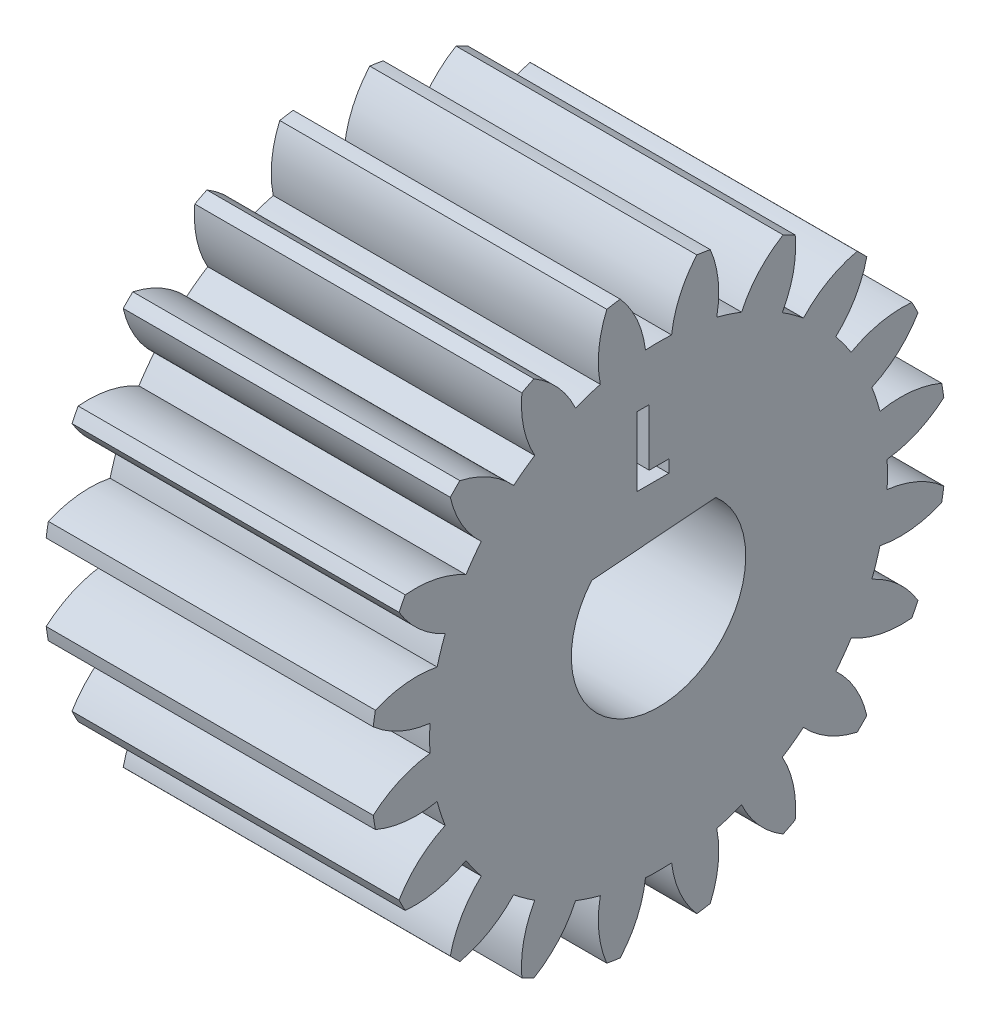
from build123d import *

# Parameters (mm, degrees)
BASPROSKE_W         = 15
BASPROSKE_H         = 13.2
TOOTHCUT_DEPTH      = 24.947442452
TEETHCUTS_COUNT     = 20
TEETHCUTS_ANGLE     = 342
BORSKE_R            = 4
BORE_DEPTH          = 50.0000508
BOSS_EXTRUDE1_START = -15
BOSS_EXTRUDE1_DEPTH = 15
SKETCH2_R           = 7.2
SKETCH2_R_2         = 6
CUT_EXTRUDE1_DEPTH  = 0.5
CUT_EXTRUDE2_DEPTH  = 2


with BuildPart() as part:
    # BasProSke → Base-Revolve (revolve)
    with BuildSketch(Plane(origin=(0, 0, 0), x_dir=(1, 0, 0), z_dir=(0, 1, 0)), mode=Mode.PRIVATE) as base_revolve_sk:
        with Locations((7.5, 6.6)):
            Rectangle(BASPROSKE_W, BASPROSKE_H)
    revolve(base_revolve_sk.sketch.rotate(Axis((-10, 0, 0), (1, 0, 0)), 180), axis=Axis((-10, 0, 0), (1, 0, 0)))

    # TooCutSke → ToothCut (cut, through all)
    with BuildSketch(Plane(origin=(0, 0, 0), x_dir=(0, 0, -1), z_dir=(1, 0, 0))):
        with BuildLine():
            ThreePointArc((0.599012827, 10.48189795), (0, 10.499), (-0.599012827, 10.48189795))
            ThreePointArc((-0.599012827, 10.48189795), (-0.986906343, 11.883983562), (-1.777012823, 13.105473306))
            ThreePointArc((-1.777012823, 13.105473306), (0, 13.2254), (1.777012823, 13.105473306))
            ThreePointArc((1.777012823, 13.105473306), (0.986906343, 11.883983562), (0.599012827, 10.48189795))
        make_face()
    toothcut = extrude(amount=TOOTHCUT_DEPTH, mode=Mode.SUBTRACT)

    # TeethCuts: ToothCut ×20 about axis
    teethcuts_axis = Axis((-10, 0, 0), (1, 0, 0))
    for i in range(1, TEETHCUTS_COUNT):
        add(toothcut.rotate(teethcuts_axis, i * TEETHCUTS_ANGLE / (TEETHCUTS_COUNT - 1)), mode=Mode.SUBTRACT)

    # BorSke → Bore (cut, symmetric)
    with BuildSketch(Plane(origin=(0, 0, 0), x_dir=(0, 0, -1), z_dir=(1, 0, 0))):
        with Locations(Location((0, 0, 0), (0, 0, 180))):
            Circle(BORSKE_R)
    extrude(amount=BORE_DEPTH, both=True, mode=Mode.SUBTRACT)

    # Sketch1 → Boss-Extrude1 (add)
    with BuildSketch(Plane.ZY.offset(BOSS_EXTRUDE1_START)):
        with BuildLine():
            Line((3.067450983, 2.567244528), (-2.628080047, 3.015492541))
            ThreePointArc((-2.628080047, 3.015492541), (0.313836383, 3.987669335), (3.067450983, 2.567244528))
        make_face()
    extrude(amount=BOSS_EXTRUDE1_DEPTH)

    # Sketch2 → Cut-Extrude1 (cut)
    with BuildSketch(Plane.ZY):
        Circle(SKETCH2_R)
        Circle(SKETCH2_R_2, mode=Mode.SUBTRACT)
    extrude(amount=-CUT_EXTRUDE1_DEPTH, mode=Mode.SUBTRACT)

    # Sketch3 → Cut-Extrude2 (cut)
    with BuildSketch(Plane(origin=(15, 0, 0), x_dir=(0, 0, -1), z_dir=(1, 0, 0))):
        Polygon((-0.996764222, 8.228081038), (-0.426892427, 8.228081038), (-0.426892427, 5.622952833), (0.468620394, 5.622952833), (0.468620394, 5.053081038), (-0.996764222, 5.053081038), align=None)
    extrude(amount=-CUT_EXTRUDE2_DEPTH, mode=Mode.SUBTRACT)


solid = part.part
